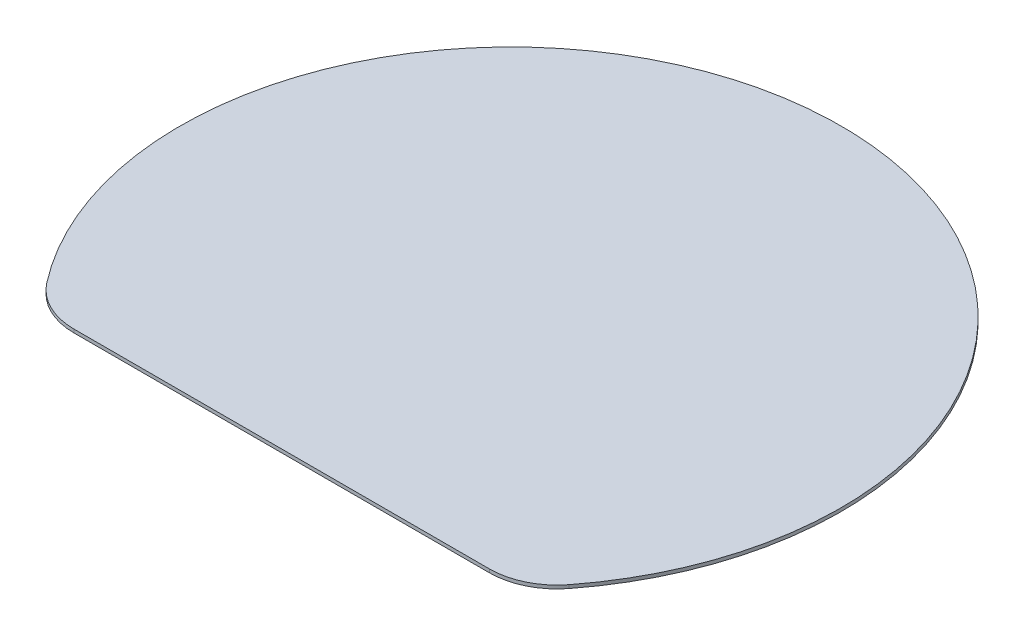
from build123d import *

# Parameters (mm, degrees)
BOSS_EXTRUDE1_DEPTH = 2
FILLET1_R           = 40


with BuildPart() as part:
    # Sketch1 → Boss-Extrude1 (new body)
    with BuildSketch(Plane(origin=(0, 0, 0), x_dir=(1, 0, 0), z_dir=(0, 1, 0))):
        with BuildLine():
            Line((-140.712472795, -135), (140.712472795, -135))
            ThreePointArc((140.712472795, -135), (0, 195), (-140.712472795, -135))
        make_face()
    extrude(amount=BOSS_EXTRUDE1_DEPTH)

    # Fillet1
    fillet1_edges = [part.edges().sort_by_distance(p)[0] for p in [
        (140.712472795, 1, 135),
        (-140.712472795, 1, 135),
    ]]
    fillet(fillet1_edges, radius=FILLET1_R)


solid = part.part
